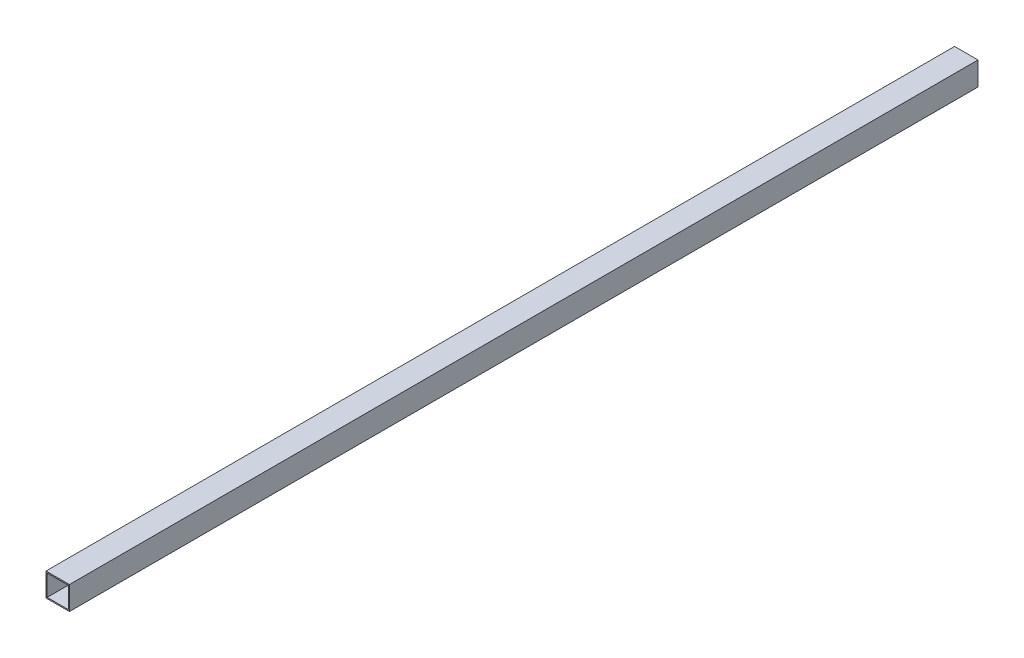
from build123d import *

# Parameters (mm, degrees)
SKETCH1_W           = 40
SKETCH1_H           = 40
SKETCH1_W_2         = 36
SKETCH1_H_2         = 36
BOSS_EXTRUDE1_DEPTH = 1551.5


with BuildPart() as part:
    # Sketch1 → Boss-Extrude1 (new body)
    with BuildSketch(Plane.XY):
        with Locations((-570, 825)):
            Rectangle(SKETCH1_W, SKETCH1_H)
        with Locations((-570, 825)):
            Rectangle(SKETCH1_W_2, SKETCH1_H_2, mode=Mode.SUBTRACT)
    extrude(amount=BOSS_EXTRUDE1_DEPTH)


solid = part.part
